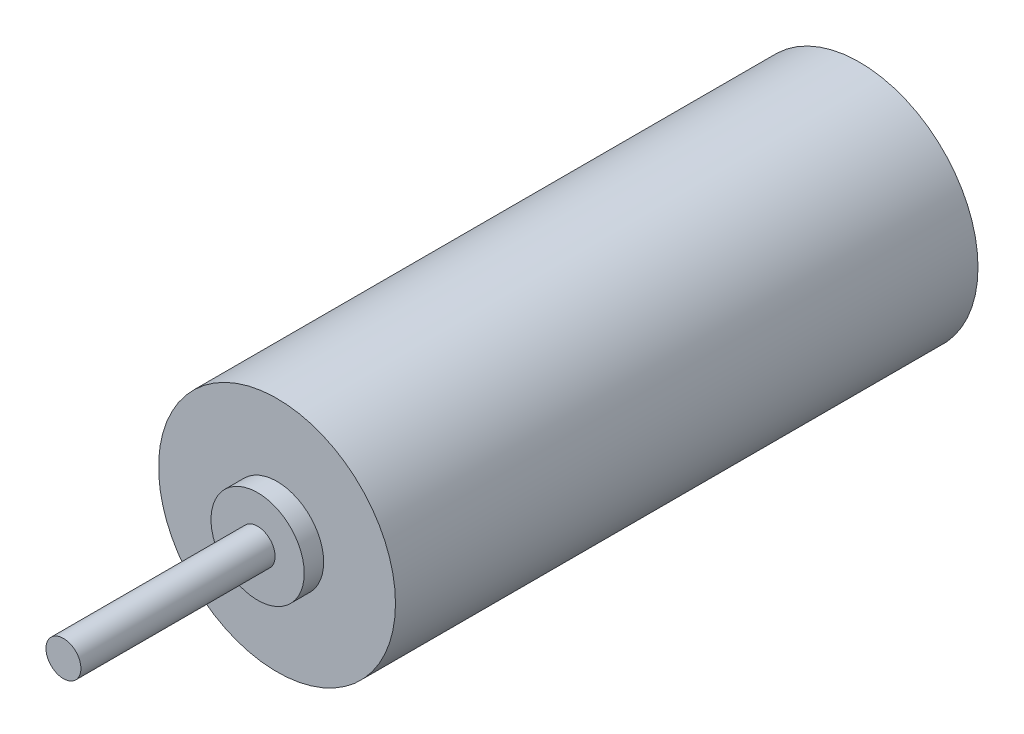
from build123d import *

# Parameters (mm, degrees)
SKETCH1_R           = 3.05
BOSS_EXTRUDE1_DEPTH = 15
SKETCH2_R           = 1.2
BOSS_EXTRUDE2_DEPTH = 0.5
SKETCH3_R           = 0.45
BOSS_EXTRUDE3_DEPTH = 5


with BuildPart() as part:
    # Sketch1 → Boss-Extrude1 (new body)
    with BuildSketch(Plane.XY):
        Circle(SKETCH1_R)
    extrude(amount=BOSS_EXTRUDE1_DEPTH)

    # Sketch2 → Boss-Extrude2 (add)
    with BuildSketch(Plane.XY.offset(15)):
        Circle(SKETCH2_R)
    extrude(amount=BOSS_EXTRUDE2_DEPTH)

    # Sketch3 → Boss-Extrude3 (add)
    with BuildSketch(Plane.XY.offset(15.5)):
        Circle(SKETCH3_R)
    extrude(amount=BOSS_EXTRUDE3_DEPTH)


solid = part.part
